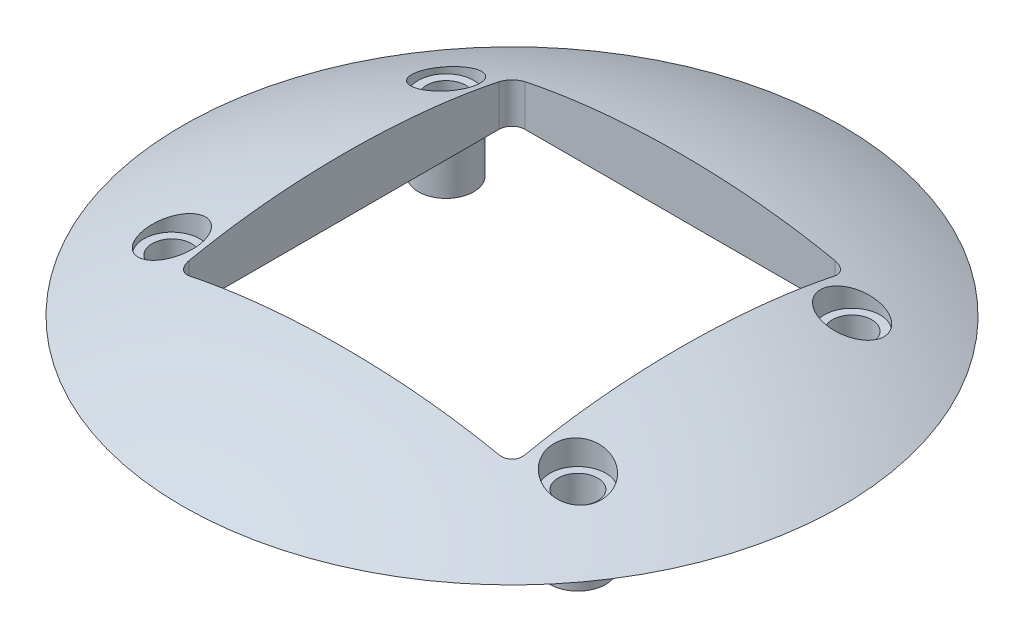
from build123d import *

# Parameters (mm, degrees)
SKETCH2_R           = 1.5
CUT_EXTRUDE1_DEPTH  = 10
CUT_EXTRUDE2_DEPTH  = 7
SKETCH4_R           = 2.125
CUT_EXTRUDE4_DEPTH  = 3.5
BOSS_EXTRUDE1_START = 3.7
SKETCH5_R           = 2.1
SKETCH5_R_2         = 1.5
BOSS_EXTRUDE1_DEPTH = 3.7


with BuildPart() as part:
    # Sketch1 → Revolve1 (revolve)
    with BuildSketch(Plane.XY):
        with BuildLine():
            Line((0, 0), (-25, 0))
            ThreePointArc((-25, 0), (-12.85331964, 4.2665982), (0, 5))
            Line((0, 5), (0, 0))
        make_face()
    revolve(axis=Axis((0, 0, 0), (0, 1, 0)))

    # Sketch2 → Cut-Extrude1 (cut)
    with BuildSketch(Plane(origin=(0, 0, 0), x_dir=(-1, 0, 0), z_dir=(0, -1, 0))):
        with Locations(Location((15.4, -10.4, 0), (0, 0, 90))):
            Circle(SKETCH2_R)
        with Locations(Location((-15.4, -10.4, 0), (0, 0, 304.757660669))):
            Circle(SKETCH2_R)
        with Locations(Location((-15.4, 10.4, 0), (0, 0, 90))):
            Circle(SKETCH2_R)
        with Locations(Location((15.4, 10.4, 0), (0, 0, 33.710682562))):
            Circle(SKETCH2_R)
    extrude(amount=-CUT_EXTRUDE1_DEPTH, mode=Mode.SUBTRACT)

    # Sketch3 → Cut-Extrude2 (cut)
    with BuildSketch(Plane(origin=(0, 0, 0), x_dir=(-1, 0, 0), z_dir=(0, -1, 0))):
        with BuildLine():
            Line((11.75, -12.75), (-11.75, -12.75))
            ThreePointArc((-11.75, -12.75), (-12.457106781, -12.457106781), (-12.75, -11.75))
            Line((-12.75, -11.75), (-12.75, 11.75))
            ThreePointArc((-12.75, 11.75), (-12.457106781, 12.457106781), (-11.75, 12.75))
            Line((-11.75, 12.75), (11.75, 12.75))
            ThreePointArc((11.75, 12.75), (12.457106781, 12.457106781), (12.75, 11.75))
            Line((12.75, 11.75), (12.75, -11.75))
            ThreePointArc((12.75, -11.75), (12.457106781, -12.457106781), (11.75, -12.75))
        make_face()
    extrude(amount=-CUT_EXTRUDE2_DEPTH, mode=Mode.SUBTRACT)

    # Sketch4 → Cut-Extrude4 (cut)
    with BuildSketch(Plane(origin=(0, 5, 0), x_dir=(1, 0, 0), z_dir=(0, 1, 0))):
        with Locations(Location((-15.4, 10.4, 0), (0, 0, 270))):
            Circle(SKETCH4_R)
        with Locations(Location((15.4, 10.4, 0), (0, 0, 127.696473345))):
            Circle(SKETCH4_R)
        with Locations(Location((15.4, -10.4, 0), (0, 0, 270))):
            Circle(SKETCH4_R)
        with Locations(Location((-15.4, -10.4, 0), (0, 0, 140.12364515))):
            Circle(SKETCH4_R)
    extrude(amount=-CUT_EXTRUDE4_DEPTH, mode=Mode.SUBTRACT)

    # Sketch5 → Boss-Extrude1 (add)
    # profile 1 of 4: a face of its own
    with BuildSketch(Plane(origin=(0, 0, 0), x_dir=(-1, 0, 0), z_dir=(0, -1, 0)).offset(BOSS_EXTRUDE1_START)):
        with Locations(Location((-15.4, -10.4, 0), (0, 0, 270))):
            Circle(SKETCH5_R)
        with Locations(Location((-15.4, -10.4, 0), (0, 0, 90))):
            Circle(SKETCH5_R_2, mode=Mode.SUBTRACT)
    # profile 2 of 4: a face of its own
    with BuildSketch(Plane(origin=(0, 0, 0), x_dir=(-1, 0, 0), z_dir=(0, -1, 0)).offset(BOSS_EXTRUDE1_START)):
        with Locations(Location((15.4, -10.4, 0), (0, 0, 270))):
            Circle(SKETCH5_R)
        with Locations(Location((15.4, -10.4, 0), (0, 0, 90))):
            Circle(SKETCH5_R_2, mode=Mode.SUBTRACT)
    # profile 3 of 4: a face of its own
    with BuildSketch(Plane(origin=(0, 0, 0), x_dir=(-1, 0, 0), z_dir=(0, -1, 0)).offset(BOSS_EXTRUDE1_START)):
        with Locations(Location((-15.4, 10.4, 0), (0, 0, 270))):
            Circle(SKETCH5_R)
        with Locations(Location((-15.4, 10.4, 0), (0, 0, 90))):
            Circle(SKETCH5_R_2, mode=Mode.SUBTRACT)
    # profile 4 of 4: a face of its own
    with BuildSketch(Plane(origin=(0, 0, 0), x_dir=(-1, 0, 0), z_dir=(0, -1, 0)).offset(BOSS_EXTRUDE1_START)):
        with Locations(Location((15.4, 10.4, 0), (0, 0, 270))):
            Circle(SKETCH5_R)
        with Locations(Location((15.4, 10.4, 0), (0, 0, 90))):
            Circle(SKETCH5_R_2, mode=Mode.SUBTRACT)
    extrude(amount=-BOSS_EXTRUDE1_DEPTH)


solid = part.part
